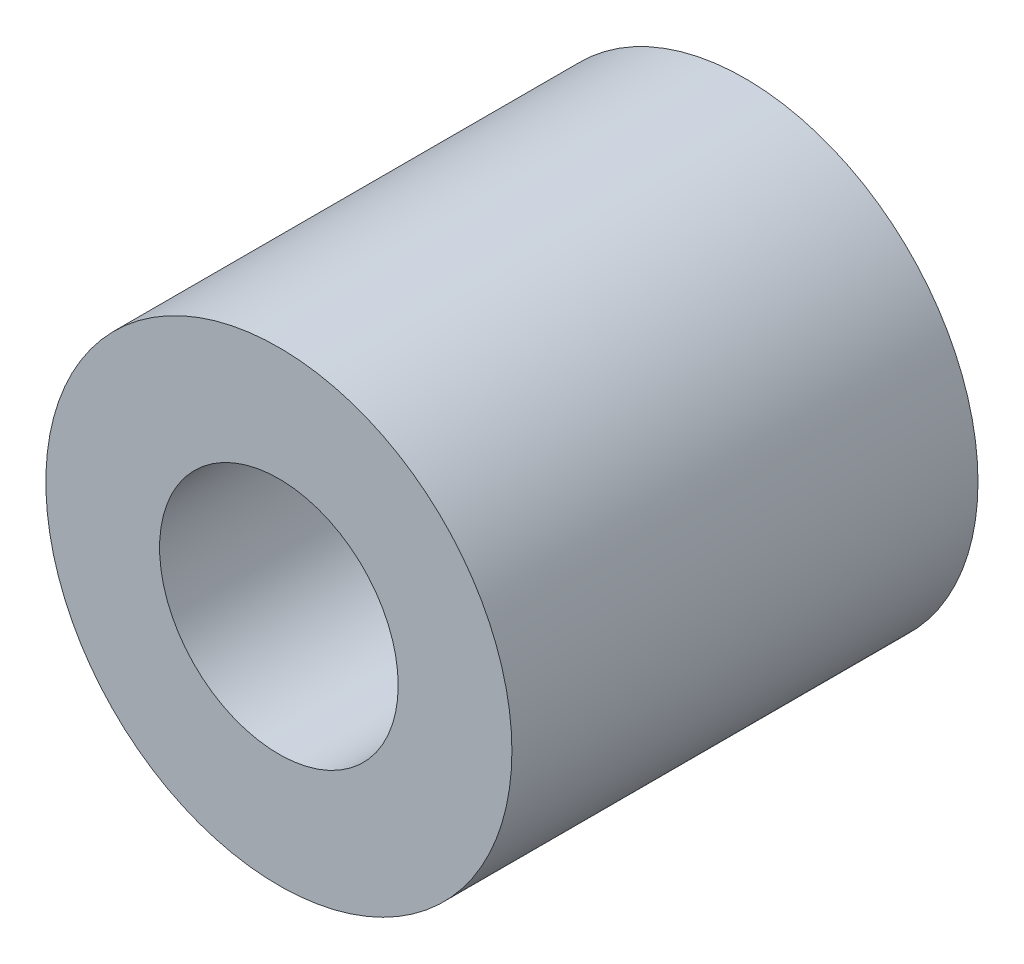
from build123d import *

# Parameters (mm, degrees)
SKETCH1_R           = 1.5875
SKETCH1_R_2         = 0.8128
BOSS_EXTRUDE1_DEPTH = 1.5875


with BuildPart() as part:
    # Sketch1 → Boss-Extrude1 (new, symmetric)
    with BuildSketch(Plane.XY):
        Circle(SKETCH1_R)
        Circle(SKETCH1_R_2, mode=Mode.SUBTRACT)
    extrude(amount=BOSS_EXTRUDE1_DEPTH, both=True)


solid = part.part
